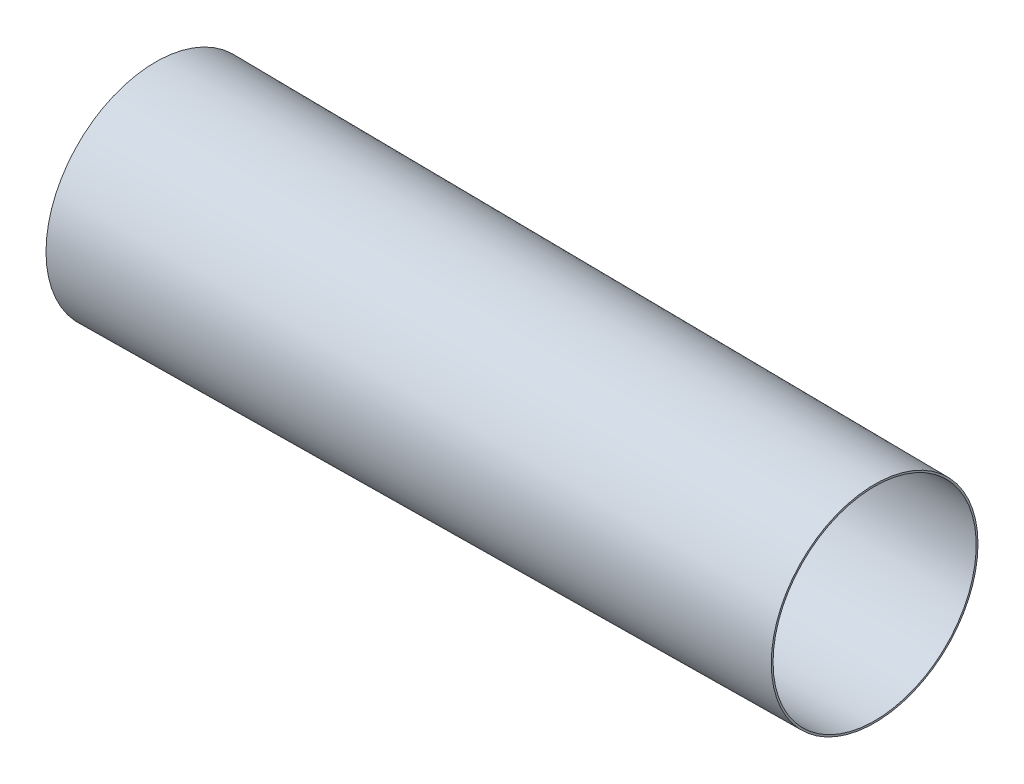
from build123d import *


with BuildPart() as part:
    # Skizze1 → Rotation1 (revolve)
    with BuildSketch(Plane(origin=(0, 0, 0), x_dir=(1, 0, 0), z_dir=(0, 1, 0)), mode=Mode.PRIVATE) as rotation1_sk:
        Polygon((0, 60), (400, 56.509252884), (400, 57.509252884), (0, 61), align=None)
    revolve(rotation1_sk.sketch.rotate(Axis((0, 0, 0), (1, 0, 0)), 180), axis=Axis((0, 0, 0), (1, 0, 0)))


solid = part.part
